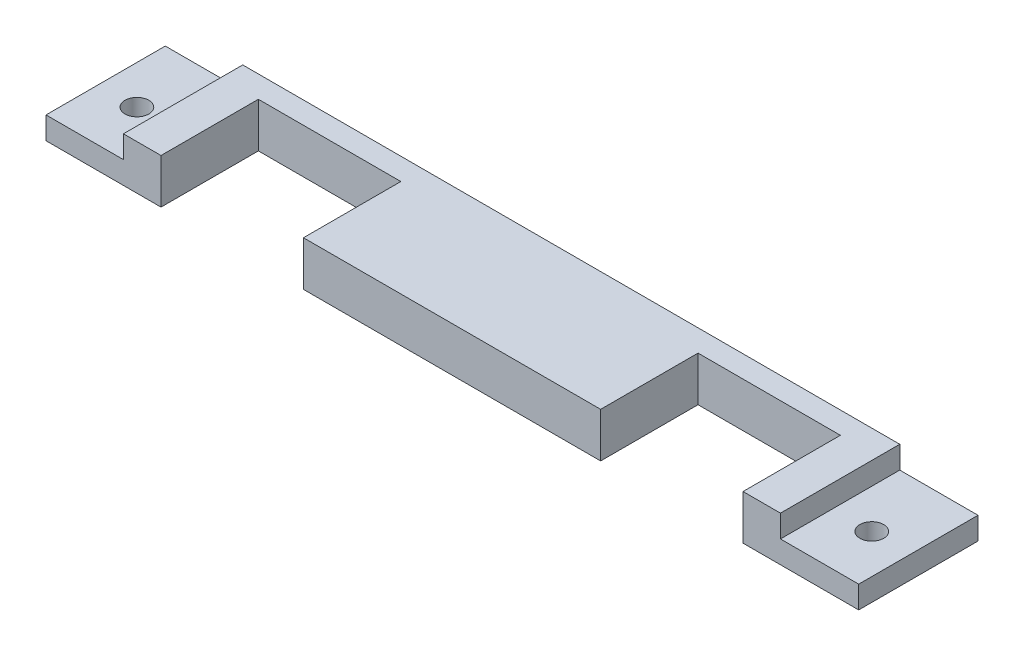
from build123d import *

# Parameters (mm, degrees)
SKETCH1_W           = 109
SKETCH1_H           = 14
BOSS_EXTRUDE1_DEPTH = 3
SKETCH2_W           = 88.121085129
SKETCH2_H           = 14
BOSS_EXTRUDE2_DEPTH = 3
SKETCH3_R           = 1.6
CUT_EXTRUDE1_DEPTH  = 3
SKETCH4_W           = 19.094363251
SKETCH4_H           = 13.060900744
SKETCH4_W_2         = 19.108315111
CUT_EXTRUDE2_DEPTH  = 6
BOSS_EXTRUDE3_DEPTH = 2


with BuildPart() as part:
    # Sketch1 → Boss-Extrude1 (new body)
    with BuildSketch(Plane(origin=(0, 0, 0), x_dir=(1, 0, 0), z_dir=(0, 1, 0))):
        with Locations((54.5, 7)):
            Rectangle(SKETCH1_W, SKETCH1_H)
    extrude(amount=BOSS_EXTRUDE1_DEPTH)

    # Sketch2 → Boss-Extrude2 (add)
    with BuildSketch(Plane(origin=(0, 3, 0), x_dir=(1, 0, 0), z_dir=(0, 1, 0))):
        with Locations((54.44553703, 7)):
            Rectangle(SKETCH2_W, SKETCH2_H)
    extrude(amount=BOSS_EXTRUDE2_DEPTH)

    # Sketch3 → Cut-Extrude1 (cut)
    with BuildSketch(Plane(origin=(0, 3, 0), x_dir=(1, 0, 0), z_dir=(0, 1, 0))):
        with Locations((5.192497233, 7)):
            Circle(SKETCH3_R)
        with Locations((103.753039797, 7)):
            Circle(SKETCH3_R)
    extrude(amount=-CUT_EXTRUDE1_DEPTH, mode=Mode.SUBTRACT)

    # Sketch4 → Cut-Extrude2 (cut)
    with BuildSketch(Plane(origin=(0, 6, 0), x_dir=(1, 0, 0), z_dir=(0, 1, 0))):
        with Locations((83.937166007, 6.530450372)):
            Rectangle(SKETCH4_W, SKETCH4_H)
        with Locations((24.977978122, 6.530450372)):
            Rectangle(SKETCH4_W_2, SKETCH4_H)
    extrude(amount=-CUT_EXTRUDE2_DEPTH, mode=Mode.SUBTRACT)

    # Sketch5 → Boss-Extrude3 (add)
    with BuildSketch(Plane(origin=(0, 0, -14), x_dir=(-1, 0, 0), z_dir=(0, 0, -1))):
        Polygon((0, 0), (0, 3), (-10.384994466, 3), (-10.384994466, 6), (-98.506079595, 6), (-98.506079595, 3), (-109, 3), (-109, 0), align=None)
    extrude(amount=BOSS_EXTRUDE3_DEPTH)


solid = part.part
